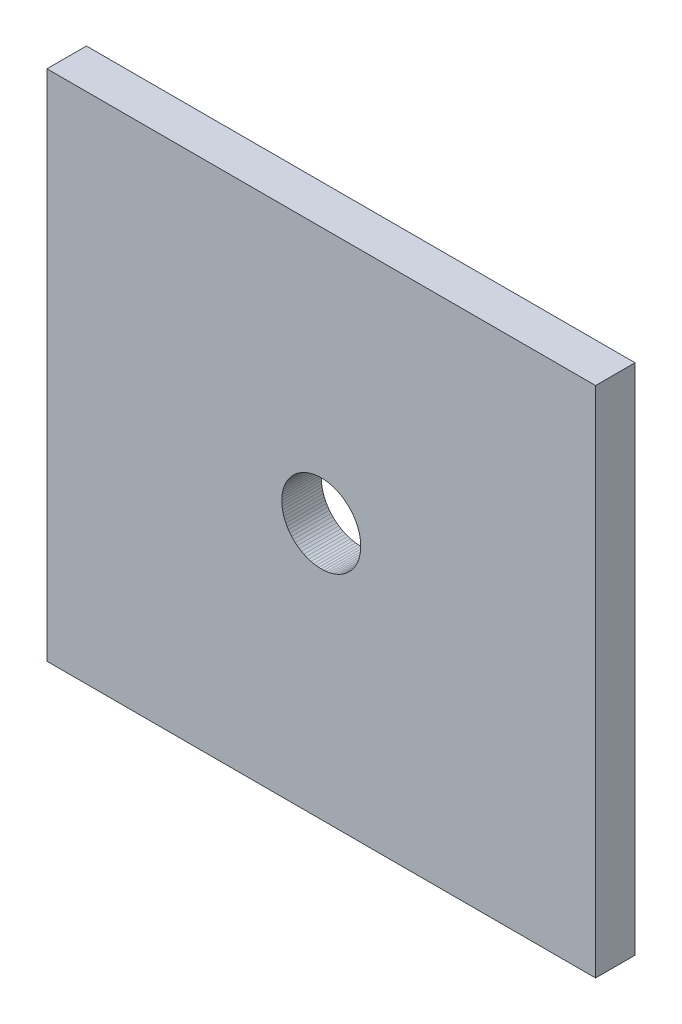
from build123d import *

# Parameters (mm, degrees)
SKETCH1_W           = 69.5
SKETCH1_H           = 65
BOSS_EXTRUDE1_DEPTH = 2.5


with BuildPart() as part:
    # Sketch1 → Boss-Extrude1 (new, symmetric)
    with BuildSketch(Plane.XY):
        with Locations((1618.295659386, -181.441167375)):
            Rectangle(SKETCH1_W, SKETCH1_H)
        Polygon((1620.795659386, -177.111040356), (1620.507102837, -176.956803667), (1620.209076548, -176.821769712), (1619.902856712, -176.706516727), (1619.589754611, -176.611538243), (1619.271110996, -176.537240973), (1618.948290347, -176.483943068), (1618.622675032, -176.451872759), (1618.295659386, -176.441167375), (1617.96864374, -176.451872759), (1617.643028425, -176.483943068), (1617.320207776, -176.537240973), (1617.00156416, -176.611538243), (1616.688462059, -176.706516727), (1616.382242224, -176.821769712), (1616.084215935, -176.956803667), (1615.795659386, -177.111040356), (1615.517808221, -177.283819313), (1615.251852241, -177.474400673), (1614.99893031, -177.681968337), (1614.76012548, -177.905633469), (1614.536460348, -178.144438299), (1614.328892684, -178.39736023), (1614.138311324, -178.66331621), (1613.965532367, -178.941167375), (1613.811295678, -179.229723924), (1613.676261723, -179.527750213), (1613.561008738, -179.833970048), (1613.466030254, -180.147072149), (1613.391732984, -180.465715765), (1613.338435079, -180.788536414), (1613.30636477, -181.114151729), (1613.295659386, -181.441167375), (1613.30636477, -181.768183021), (1613.338435079, -182.093798336), (1613.391732984, -182.416618985), (1613.466030254, -182.7352626), (1613.561008738, -183.048364701), (1613.676261723, -183.354584537), (1613.811295678, -183.652610826), (1613.965532367, -183.941167375), (1614.138311324, -184.21901854), (1614.328892684, -184.48497452), (1614.536460348, -184.73789645), (1614.76012548, -184.976701281), (1614.99893031, -185.200366412), (1615.251852241, -185.407934076), (1615.517808221, -185.598515436), (1615.795659386, -185.771294394), (1616.084215935, -185.925531082), (1616.382242224, -186.060565037), (1616.688462059, -186.175818022), (1617.00156416, -186.270796506), (1617.320207776, -186.345093777), (1617.643028425, -186.398391682), (1617.96864374, -186.430461991), (1618.295659386, -186.441167375), (1618.622675032, -186.430461991), (1618.948290347, -186.398391682), (1619.271110996, -186.345093777), (1619.589754611, -186.270796506), (1619.902856712, -186.175818022), (1620.209076548, -186.060565037), (1620.507102837, -185.925531082), (1620.795659386, -185.771294394), (1621.073510551, -185.598515436), (1621.339466531, -185.407934076), (1621.592388461, -185.200366412), (1621.831193292, -184.976701281), (1622.054858423, -184.73789645), (1622.262426087, -184.48497452), (1622.453007447, -184.21901854), (1622.625786405, -183.941167375), (1622.780023094, -183.652610826), (1622.915057048, -183.354584537), (1623.030310033, -183.048364701), (1623.125288517, -182.7352626), (1623.199585788, -182.416618985), (1623.252883693, -182.093798336), (1623.284954002, -181.768183021), (1623.295659386, -181.441167375), (1623.284954002, -181.114151729), (1623.252883693, -180.788536414), (1623.199585788, -180.465715765), (1623.125288517, -180.147072149), (1623.030310033, -179.833970048), (1622.915057048, -179.527750213), (1622.780023094, -179.229723924), (1622.625786405, -178.941167375), (1622.453007447, -178.66331621), (1622.262426087, -178.39736023), (1622.054858423, -178.144438299), (1621.831193292, -177.905633469), (1621.592388461, -177.681968337), (1621.339466531, -177.474400673), (1621.073510551, -177.283819313), align=None, mode=Mode.SUBTRACT)
    extrude(amount=BOSS_EXTRUDE1_DEPTH, both=True)


solid = part.part
